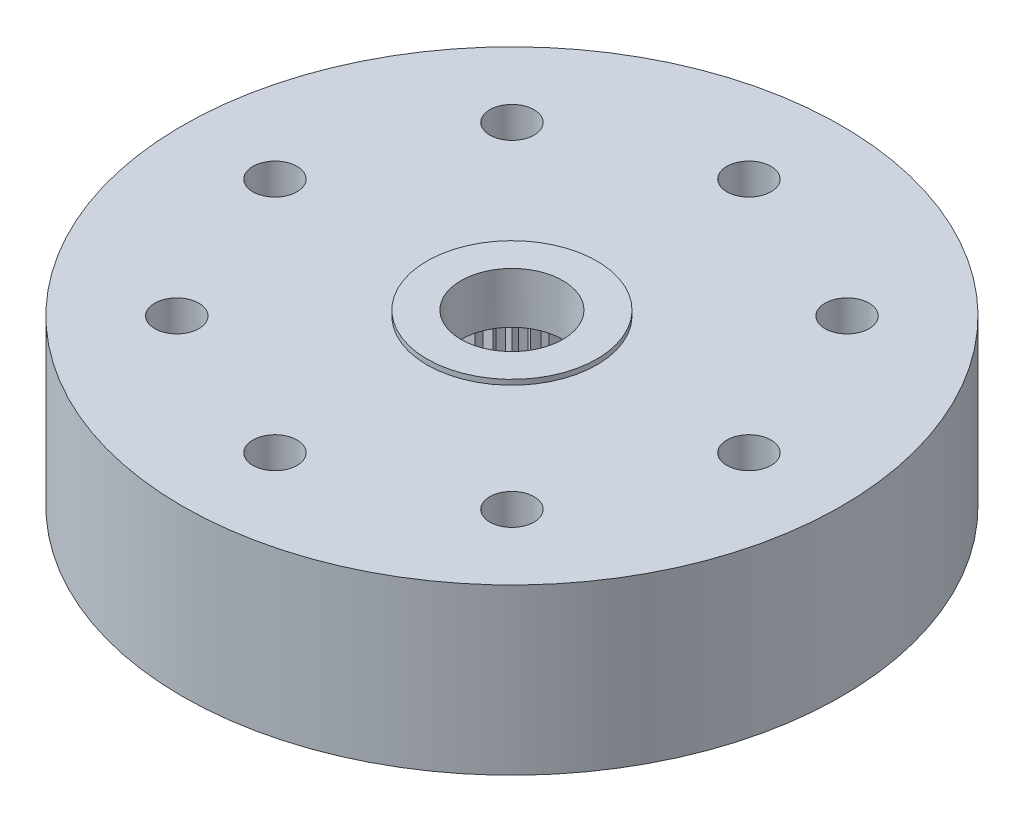
from build123d import *

# Parameters (mm, degrees)
SKETCH1_R               = 9.7
BOSS_EXTRUDE1_DEPTH     = 5
CUT_EXTRUDE1_DEPTH      = 15.600684915
CUT_EXTRUDE1_DEPTH_BACK = 15.600684915
SKETCH2_R               = 0.65
CUT_EXTRUDE2_DEPTH      = 15.600684915
CUT_EXTRUDE2_DEPTH_BACK = 15.600684915
SKETCH3_R               = 1.5
SKETCH4_R               = 9.7
SKETCH4_R_2             = 2.5
SKETCH4_R_3             = 0.65
CUT_EXTRUDE3_DEPTH      = 0.15
CUT_EXTRUDE4_DEPTH      = 3.5


with BuildPart() as part:
    # Sketch1 → Boss-Extrude1 (new body)
    with BuildSketch(Plane(origin=(0, 0, 0), x_dir=(1, 0, 0), z_dir=(0, 1, 0))):
        with Locations(Location((0, 0, 0), (0, 0, 270))):
            Circle(SKETCH1_R)
    extrude(amount=BOSS_EXTRUDE1_DEPTH)

    # Sketch2 → Cut-Extrude1 (cut, two sides: drawn at the far end of the back side and taken through both)
    with BuildSketch(Plane(origin=(0, 5, 0), x_dir=(1, 0, 0), z_dir=(0, 1, 0)).offset(-CUT_EXTRUDE1_DEPTH_BACK)):
        with Locations(Location((-6.975, 0, 0), (0, 0, 270))):
            Circle(SKETCH2_R)
        with Locations(Location((-4.932069799, 4.932069799, 0), (0, 0, 270))):
            Circle(SKETCH2_R)
        with Locations(Location((0, 6.975, 0), (0, 0, 270))):
            Circle(SKETCH2_R)
        with Locations(Location((4.932069799, 4.932069799, 0), (0, 0, 270))):
            Circle(SKETCH2_R)
        with Locations(Location((6.975, 0, 0), (0, 0, 270))):
            Circle(SKETCH2_R)
        with Locations(Location((4.932069799, -4.932069799, 0), (0, 0, 270))):
            Circle(SKETCH2_R)
        with Locations(Location((0, -6.975, 0), (0, 0, 270))):
            Circle(SKETCH2_R)
        with Locations(Location((-4.932069799, -4.932069799, 0), (0, 0, 270))):
            Circle(SKETCH2_R)
    extrude(amount=CUT_EXTRUDE1_DEPTH + CUT_EXTRUDE1_DEPTH_BACK, mode=Mode.SUBTRACT)

    # Sketch3 → Cut-Extrude2 (cut, two sides: drawn at the far end of the back side and taken through both)
    with BuildSketch(Plane(origin=(0, 5, 0), x_dir=(1, 0, 0), z_dir=(0, 1, 0)).offset(-CUT_EXTRUDE2_DEPTH_BACK)):
        with Locations(Location((0, 0, 0), (0, 0, 270))):
            Circle(SKETCH3_R)
    extrude(amount=CUT_EXTRUDE2_DEPTH + CUT_EXTRUDE2_DEPTH_BACK, mode=Mode.SUBTRACT)

    # Sketch4 → Cut-Extrude3 (cut)
    with BuildSketch(Plane(origin=(0, 5, 0), x_dir=(1, 0, 0), z_dir=(0, 1, 0))):
        with Locations(Location((0, 0, 0), (0, 0, 270))):
            Circle(SKETCH4_R)
        with Locations(Location((0, 0, 0), (0, 0, 270))):
            Circle(SKETCH4_R_2, mode=Mode.SUBTRACT)
        with Locations(Location((-6.975, 0, 0), (0, 0, 270))):
            Circle(SKETCH4_R_3, mode=Mode.SUBTRACT)
        with Locations(Location((0, 6.975, 0), (0, 0, 270))):
            Circle(SKETCH4_R_3, mode=Mode.SUBTRACT)
        with Locations(Location((6.975, 0, 0), (0, 0, 270))):
            Circle(SKETCH4_R_3, mode=Mode.SUBTRACT)
        with Locations(Location((0, -6.975, 0), (0, 0, 270))):
            Circle(SKETCH4_R_3, mode=Mode.SUBTRACT)
        with Locations(Location((-4.932069799, -4.932069799, 0), (0, 0, 270))):
            Circle(SKETCH4_R_3, mode=Mode.SUBTRACT)
        with Locations(Location((4.932069799, -4.932069799, 0), (0, 0, 270))):
            Circle(SKETCH4_R_3, mode=Mode.SUBTRACT)
        with Locations(Location((4.932069799, 4.932069799, 0), (0, 0, 270))):
            Circle(SKETCH4_R_3, mode=Mode.SUBTRACT)
        with Locations(Location((-4.932069799, 4.932069799, 0), (0, 0, 270))):
            Circle(SKETCH4_R_3, mode=Mode.SUBTRACT)
    extrude(amount=-CUT_EXTRUDE3_DEPTH, mode=Mode.SUBTRACT)

    # Sketch5 → Cut-Extrude4 (cut)
    with BuildSketch(Plane.XZ):
        with BuildLine():
            Line((-0.602683972, -2.938838551), (-0.391086156, -2.469220853))
            Line((-0.391086156, -2.469220853), (-0.33496452, -2.981241146))
            ThreePointArc((-0.33496452, -2.981241146), (-0.235377283, -2.990752002), (-0.135528304, -2.996937116))
            Line((-0.135528304, -2.996937116), (0, -2.5))
            Line((0, -2.5), (0.135528304, -2.996937116))
            ThreePointArc((0.135528304, -2.996937116), (0.235377287, -2.990752001), (0.334964528, -2.981241145))
            Line((0.334964528, -2.981241145), (0.391086162, -2.469220852))
            Line((0.391086162, -2.469220852), (0.60268398, -2.93883855))
            ThreePointArc((0.60268398, -2.93883855), (0.700336079, -2.917109764), (0.797209399, -2.892137129))
            Line((0.797209399, -2.892137129), (0.772542467, -2.377641297))
            Line((0.772542467, -2.377641297), (1.054999554, -2.808376033))
            ThreePointArc((1.054999554, -2.808376033), (1.148050284, -2.771638603), (1.239824372, -2.731819088))
            Line((1.239824372, -2.731819088), (1.134976246, -2.227516312))
            Line((1.134976246, -2.227516312), (1.481337579, -2.608761963))
            ThreePointArc((1.481337579, -2.608761963), (1.567495694, -2.557920493), (1.651910742, -2.504234594))
            Line((1.651910742, -2.504234594), (1.469463134, -2.022542483))
            Line((1.469463134, -2.022542483), (1.871200145, -2.344911516))
            ThreePointArc((1.871200145, -2.344911516), (1.948344157, -2.281217887), (2.023321594, -2.214987523))
            Line((2.023321594, -2.214987523), (1.767766968, -1.767766938))
            Line((1.767766968, -1.767766938), (2.214987558, -2.023321555))
            ThreePointArc((2.214987558, -2.023321555), (2.28121791, -1.94834413), (2.344911528, -1.87120013))
            Line((2.344911528, -1.87120013), (2.022542492, -1.469463122))
            Line((2.022542492, -1.469463122), (2.504234604, -1.651910726))
            ThreePointArc((2.504234604, -1.651910726), (2.557920507, -1.567495672), (2.60876198, -1.481337548))
            Line((2.60876198, -1.481337548), (2.227516326, -1.13497622))
            Line((2.227516326, -1.13497622), (2.731819102, -1.239824339))
            ThreePointArc((2.731819102, -1.239824339), (2.771638627, -1.148050226), (2.808376064, -1.05499947))
            Line((2.808376064, -1.05499947), (2.37764132, -0.772542395))
            Line((2.37764132, -0.772542395), (2.892137153, -0.797209313))
            ThreePointArc((2.892137153, -0.797209313), (2.917109775, -0.700336032), (2.938838551, -0.602683973))
            Line((2.938838551, -0.602683973), (2.469220853, -0.391086156))
            Line((2.469220853, -0.391086156), (2.981241146, -0.33496452))
            ThreePointArc((2.981241146, -0.33496452), (2.990752002, -0.235377283), (2.996937116, -0.135528304))
            Line((2.996937116, -0.135528304), (2.5, 0))
            Line((2.5, 0), (2.996937116, 0.135528304))
            ThreePointArc((2.996937116, 0.135528304), (2.990752001, 0.235377287), (2.981241145, 0.334964528))
            Line((2.981241145, 0.334964528), (2.469220852, 0.391086162))
            Line((2.469220852, 0.391086162), (2.93883855, 0.60268398))
            ThreePointArc((2.93883855, 0.60268398), (2.917109764, 0.700336079), (2.892137129, 0.797209399))
            Line((2.892137129, 0.797209399), (2.377641297, 0.772542467))
            Line((2.377641297, 0.772542467), (2.808376033, 1.054999554))
            ThreePointArc((2.808376033, 1.054999554), (2.771638603, 1.148050284), (2.731819088, 1.239824372))
            Line((2.731819088, 1.239824372), (2.227516312, 1.134976246))
            Line((2.227516312, 1.134976246), (2.608761963, 1.481337579))
            ThreePointArc((2.608761963, 1.481337579), (2.557920493, 1.567495694), (2.504234594, 1.651910742))
            Line((2.504234594, 1.651910742), (2.022542483, 1.469463134))
            Line((2.022542483, 1.469463134), (2.344911516, 1.871200145))
            ThreePointArc((2.344911516, 1.871200145), (2.281217887, 1.948344157), (2.214987523, 2.023321594))
            Line((2.214987523, 2.023321594), (1.767766938, 1.767766968))
            Line((1.767766938, 1.767766968), (2.023321555, 2.214987558))
            ThreePointArc((2.023321555, 2.214987558), (1.94834413, 2.28121791), (1.87120013, 2.344911528))
            Line((1.87120013, 2.344911528), (1.469463122, 2.022542492))
            Line((1.469463122, 2.022542492), (1.651910726, 2.504234604))
            ThreePointArc((1.651910726, 2.504234604), (1.567495672, 2.557920507), (1.481337548, 2.60876198))
            Line((1.481337548, 2.60876198), (1.13497622, 2.227516326))
            Line((1.13497622, 2.227516326), (1.239824339, 2.731819102))
            ThreePointArc((1.239824339, 2.731819102), (1.148050226, 2.771638627), (1.05499947, 2.808376064))
            Line((1.05499947, 2.808376064), (0.772542395, 2.37764132))
            Line((0.772542395, 2.37764132), (0.797209313, 2.892137153))
            ThreePointArc((0.797209313, 2.892137153), (0.700336032, 2.917109775), (0.602683972, 2.938838551))
            Line((0.602683972, 2.938838551), (0.391086156, 2.469220853))
            Line((0.391086156, 2.469220853), (0.33496452, 2.981241146))
            ThreePointArc((0.33496452, 2.981241146), (0.235377283, 2.990752002), (0.135528304, 2.996937116))
            Line((0.135528304, 2.996937116), (0, 2.5))
            Line((0, 2.5), (-0.135528304, 2.996937116))
            ThreePointArc((-0.135528304, 2.996937116), (-0.235377287, 2.990752001), (-0.334964528, 2.981241145))
            Line((-0.334964528, 2.981241145), (-0.391086162, 2.469220852))
            Line((-0.391086162, 2.469220852), (-0.60268398, 2.93883855))
            ThreePointArc((-0.60268398, 2.93883855), (-0.700336079, 2.917109764), (-0.797209399, 2.892137129))
            Line((-0.797209399, 2.892137129), (-0.772542467, 2.377641297))
            Line((-0.772542467, 2.377641297), (-1.054999554, 2.808376033))
            ThreePointArc((-1.054999554, 2.808376033), (-1.148050284, 2.771638603), (-1.239824372, 2.731819088))
            Line((-1.239824372, 2.731819088), (-1.134976246, 2.227516312))
            Line((-1.134976246, 2.227516312), (-1.481337579, 2.608761963))
            ThreePointArc((-1.481337579, 2.608761963), (-1.567495694, 2.557920493), (-1.651910742, 2.504234594))
            Line((-1.651910742, 2.504234594), (-1.469463134, 2.022542483))
            Line((-1.469463134, 2.022542483), (-1.871200145, 2.344911516))
            ThreePointArc((-1.871200145, 2.344911516), (-1.948344157, 2.281217887), (-2.023321594, 2.214987523))
            Line((-2.023321594, 2.214987523), (-1.767766968, 1.767766938))
            Line((-1.767766968, 1.767766938), (-2.214987558, 2.023321555))
            ThreePointArc((-2.214987558, 2.023321555), (-2.28121791, 1.94834413), (-2.344911528, 1.87120013))
            Line((-2.344911528, 1.87120013), (-2.022542492, 1.469463122))
            Line((-2.022542492, 1.469463122), (-2.504234604, 1.651910726))
            ThreePointArc((-2.504234604, 1.651910726), (-2.557920507, 1.567495672), (-2.60876198, 1.481337548))
            Line((-2.60876198, 1.481337548), (-2.227516326, 1.13497622))
            Line((-2.227516326, 1.13497622), (-2.731819102, 1.239824339))
            ThreePointArc((-2.731819102, 1.239824339), (-2.771638627, 1.148050226), (-2.808376064, 1.05499947))
            Line((-2.808376064, 1.05499947), (-2.37764132, 0.772542395))
            Line((-2.37764132, 0.772542395), (-2.892137153, 0.797209313))
            ThreePointArc((-2.892137153, 0.797209313), (-2.917109775, 0.700336032), (-2.938838551, 0.602683972))
            Line((-2.938838551, 0.602683972), (-2.469220853, 0.391086156))
            Line((-2.469220853, 0.391086156), (-2.981241146, 0.33496452))
            ThreePointArc((-2.981241146, 0.33496452), (-2.990752002, 0.235377283), (-2.996937116, 0.135528304))
            Line((-2.996937116, 0.135528304), (-2.5, 0))
            Line((-2.5, 0), (-2.996937116, -0.135528304))
            ThreePointArc((-2.996937116, -0.135528304), (-2.990752001, -0.235377287), (-2.981241145, -0.334964528))
            Line((-2.981241145, -0.334964528), (-2.469220852, -0.391086162))
            Line((-2.469220852, -0.391086162), (-2.93883855, -0.60268398))
            ThreePointArc((-2.93883855, -0.60268398), (-2.917109764, -0.700336079), (-2.892137129, -0.797209399))
            Line((-2.892137129, -0.797209399), (-2.377641297, -0.772542467))
            Line((-2.377641297, -0.772542467), (-2.808376033, -1.054999554))
            ThreePointArc((-2.808376033, -1.054999554), (-2.771638603, -1.148050284), (-2.731819088, -1.239824372))
            Line((-2.731819088, -1.239824372), (-2.227516312, -1.134976246))
            Line((-2.227516312, -1.134976246), (-2.608761963, -1.481337579))
            ThreePointArc((-2.608761963, -1.481337579), (-2.557920493, -1.567495694), (-2.504234594, -1.651910742))
            Line((-2.504234594, -1.651910742), (-2.022542483, -1.469463134))
            Line((-2.022542483, -1.469463134), (-2.344911516, -1.871200145))
            ThreePointArc((-2.344911516, -1.871200145), (-2.281217887, -1.948344157), (-2.214987523, -2.023321594))
            Line((-2.214987523, -2.023321594), (-1.767766938, -1.767766968))
            Line((-1.767766938, -1.767766968), (-2.023321555, -2.214987558))
            ThreePointArc((-2.023321555, -2.214987558), (-1.94834413, -2.28121791), (-1.87120013, -2.344911528))
            Line((-1.87120013, -2.344911528), (-1.469463122, -2.022542492))
            Line((-1.469463122, -2.022542492), (-1.651910726, -2.504234604))
            ThreePointArc((-1.651910726, -2.504234604), (-1.567495672, -2.557920507), (-1.481337548, -2.60876198))
            Line((-1.481337548, -2.60876198), (-1.13497622, -2.227516326))
            Line((-1.13497622, -2.227516326), (-1.239824339, -2.731819102))
            ThreePointArc((-1.239824339, -2.731819102), (-1.148050226, -2.771638627), (-1.05499947, -2.808376064))
            Line((-1.05499947, -2.808376064), (-0.772542395, -2.37764132))
            Line((-0.772542395, -2.37764132), (-0.797209313, -2.892137153))
            ThreePointArc((-0.797209313, -2.892137153), (-0.700336032, -2.917109775), (-0.602683972, -2.938838551))
        make_face()
    extrude(amount=-CUT_EXTRUDE4_DEPTH, mode=Mode.SUBTRACT)


solid = part.part
